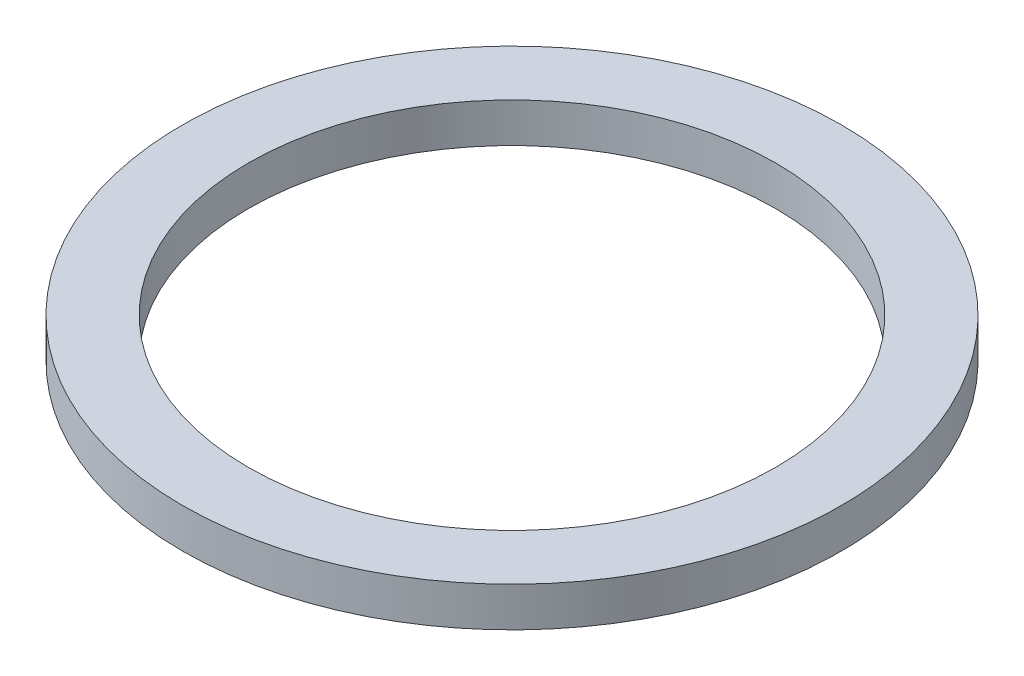
from build123d import *

# Parameters (mm, degrees)
SKETCH1_R           = 25
SKETCH1_R_2         = 20
BOSS_EXTRUDE1_DEPTH = 3


with BuildPart() as part:
    # Sketch1 → Boss-Extrude1 (new body)
    with BuildSketch(Plane(origin=(0, 0, 0), x_dir=(1, 0, 0), z_dir=(0, 1, 0))):
        with Locations(Location((0, 0, 0), (0, 0, 270))):
            Circle(SKETCH1_R)
        with Locations(Location((0, 0, 0), (0, 0, 270))):
            Circle(SKETCH1_R_2, mode=Mode.SUBTRACT)
    extrude(amount=BOSS_EXTRUDE1_DEPTH)


solid = part.part
